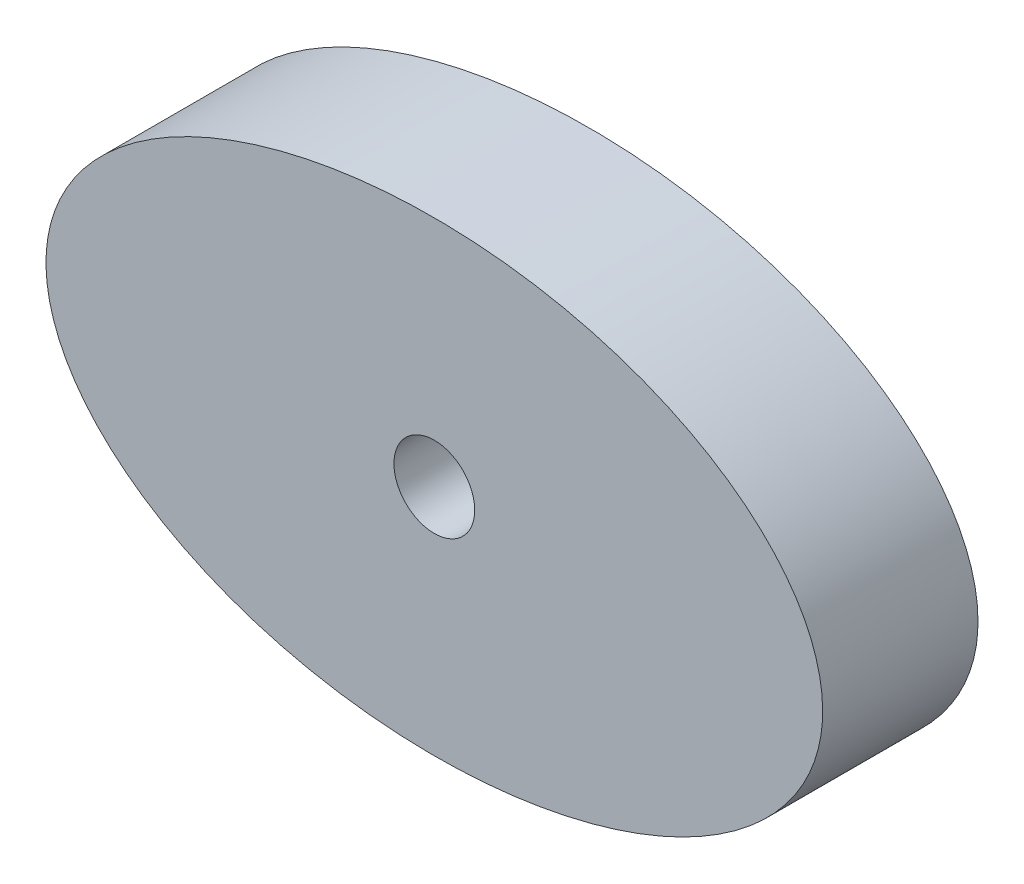
from build123d import *

# Parameters (mm, degrees)
CROQUIS2_RX             = 25
CROQUIS2_RY             = 15
CROQUIS2_R              = 2.6
SALIENTE_EXTRUIR1_DEPTH = 5


with BuildPart() as part:
    # Croquis2 → Saliente-Extruir1 (new, symmetric)
    with BuildSketch(Plane.XY):
        with Locations((0, 0)):
            Ellipse(CROQUIS2_RX, CROQUIS2_RY)
        Circle(CROQUIS2_R, mode=Mode.SUBTRACT)
    extrude(amount=SALIENTE_EXTRUIR1_DEPTH, both=True)


solid = part.part
